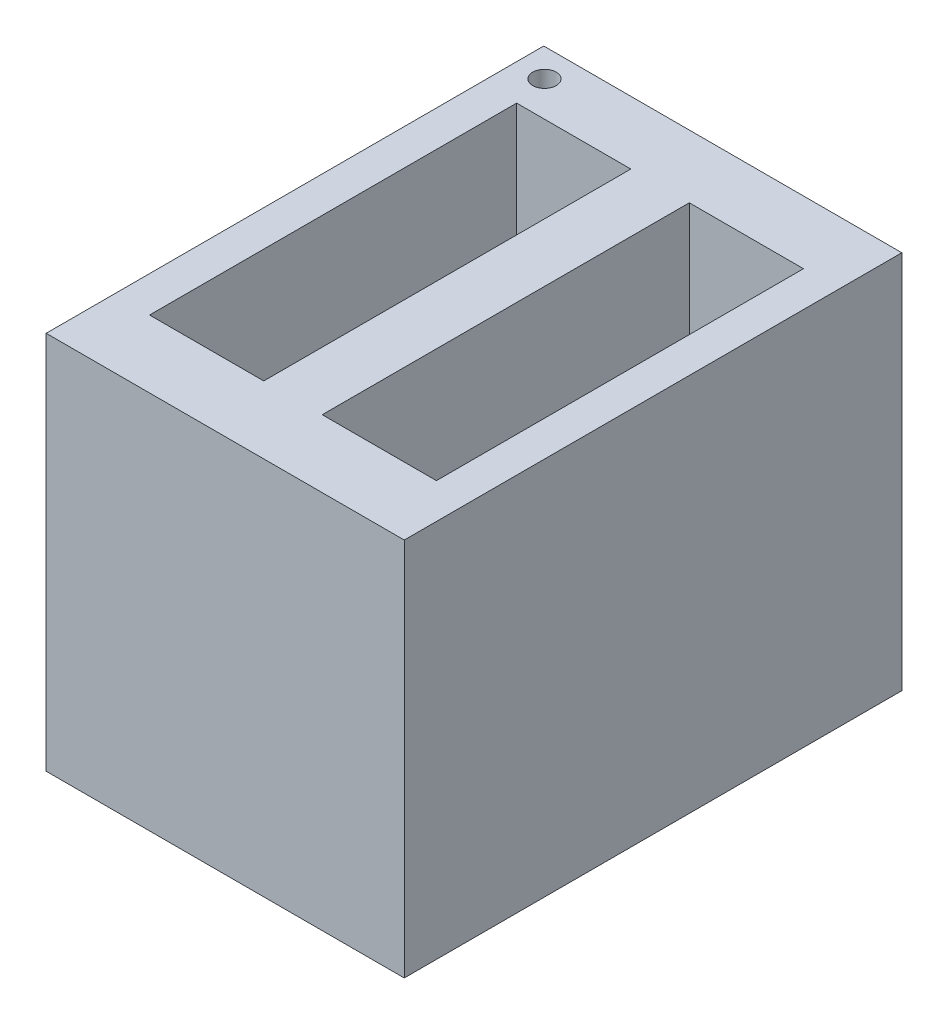
from build123d import *

# Parameters (mm, degrees)
CROQUIS1_W              = 4.39
CROQUIS1_H              = 6.1
SALIENTE_EXTRUIR1_DEPTH = 4.65
CROQUIS3_W              = 1.4
CROQUIS3_H              = 4.5
CORTAR_EXTRUIR1_DEPTH   = 9.837680691
CROQUIS4_R              = 0.143820832
CORTAR_EXTRUIR2_DEPTH   = 0.25


with BuildPart() as part:
    # Croquis1 → Saliente-Extruir1 (new body)
    with BuildSketch(Plane(origin=(0, 0, 0), x_dir=(1, 0, 0), z_dir=(0, 1, 0))):
        with Locations((2.195, 3.05)):
            Rectangle(CROQUIS1_W, CROQUIS1_H)
    extrude(amount=SALIENTE_EXTRUIR1_DEPTH)

    # Croquis3 → Cortar-Extruir1 (cut, through all)
    with BuildSketch(Plane(origin=(0, 4.65, 0), x_dir=(1, 0, 0), z_dir=(0, 1, 0))):
        with Locations((1.14, 3.077612144)):
            Rectangle(CROQUIS3_W, CROQUIS3_H)
        with Locations((3.256764551, 3.077612144)):
            Rectangle(CROQUIS3_W, CROQUIS3_H)
    extrude(amount=-CORTAR_EXTRUIR1_DEPTH, mode=Mode.SUBTRACT)

    # Croquis4 → Cortar-Extruir2 (cut)
    with BuildSketch(Plane(origin=(0, 4.65, 0), x_dir=(1, 0, 0), z_dir=(0, 1, 0))):
        with Locations(Location((0.353367476, 5.755686139, 0), (0, 0, 270))):
            Circle(CROQUIS4_R)
    extrude(amount=-CORTAR_EXTRUIR2_DEPTH, mode=Mode.SUBTRACT)


solid = part.part
